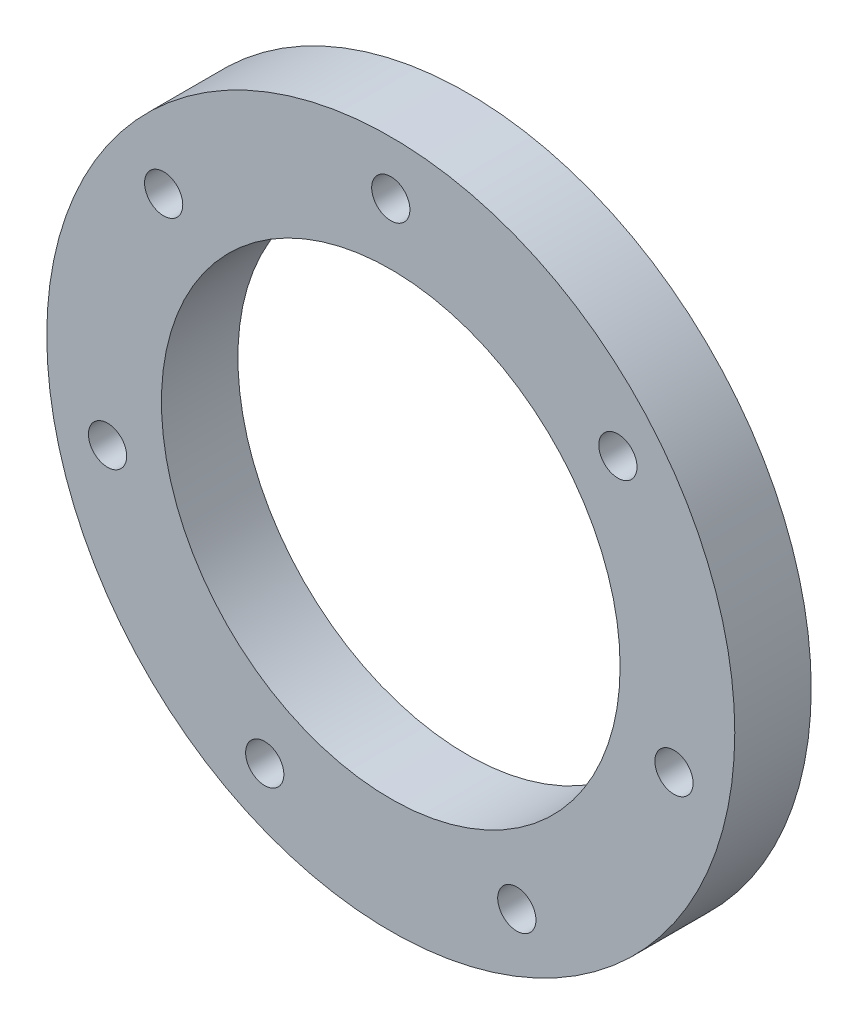
from build123d import *

# Parameters (mm, degrees)
SKETCH1_R           = 22.5
SKETCH1_R_2         = 1.25
SKETCH1_R_3         = 15
BOSS_EXTRUDE1_DEPTH = 5


with BuildPart() as part:
    # Sketch1 → Boss-Extrude1 (new body)
    with BuildSketch(Plane.XY):
        Circle(SKETCH1_R)
        with Locations((0, 19)):
            Circle(SKETCH1_R_2, mode=Mode.SUBTRACT)
        with Locations((14.854798167, 11.846306235)):
            Circle(SKETCH1_R_2, mode=Mode.SUBTRACT)
        with Locations((18.523630331, -4.227897745)):
            Circle(SKETCH1_R_2, mode=Mode.SUBTRACT)
        with Locations((8.243791043, -17.11840849)):
            Circle(SKETCH1_R_2, mode=Mode.SUBTRACT)
        with Locations((-8.243791043, -17.11840849)):
            Circle(SKETCH1_R_2, mode=Mode.SUBTRACT)
        with Locations((-18.523630331, -4.227897745)):
            Circle(SKETCH1_R_2, mode=Mode.SUBTRACT)
        Circle(SKETCH1_R_3, mode=Mode.SUBTRACT)
        with Locations((-14.854798167, 11.846306235)):
            Circle(SKETCH1_R_2, mode=Mode.SUBTRACT)
    extrude(amount=BOSS_EXTRUDE1_DEPTH)


solid = part.part
